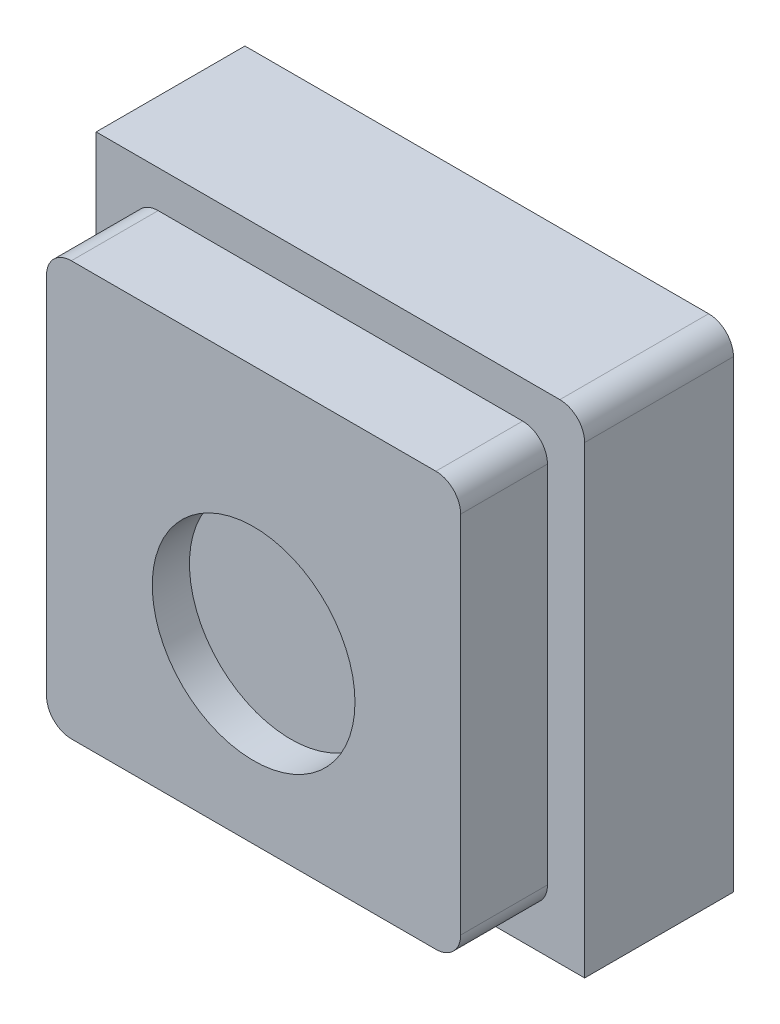
from build123d import *

# Parameters (mm, degrees)
ESQUISSE1_W             = 33.4
ESQUISSE1_H             = 33.4
BOSS_EXTRU_1_DEPTH      = 7
ESQUISSE2_R             = 8.175
ENL_V_MAT_EXTRU_1_DEPTH = 3
ESQUISSE3_W             = 39.4
ESQUISSE3_H             = 39.4
BOSS_EXTRU_2_DEPTH      = 2
BOSS_EXTRU_3_DEPTH      = 10
CONG_1_R                = 2


with BuildPart() as part:
    # Esquisse1 → Boss.-Extru.1 (new body)
    with BuildSketch(Plane.XY):
        Rectangle(ESQUISSE1_W, ESQUISSE1_H)
    extrude(amount=BOSS_EXTRU_1_DEPTH)

    # Esquisse2 → Enlèv. mat.-Extru.1 (cut)
    with BuildSketch(Plane.XY.offset(7)):
        with Locations((0, -2.7)):
            Circle(ESQUISSE2_R)
    extrude(amount=-ENL_V_MAT_EXTRU_1_DEPTH, mode=Mode.SUBTRACT)

    # Esquisse3 → Boss.-Extru.2 (add)
    with BuildSketch(Plane(origin=(0, 0, 0), x_dir=(-1, 0, 0), z_dir=(0, 0, -1))):
        Rectangle(ESQUISSE3_W, ESQUISSE3_H)
    extrude(amount=BOSS_EXTRU_2_DEPTH)

    # Esquisse4 → Boss.-Extru.3 (add)
    with BuildSketch(Plane(origin=(0, 0, -2), x_dir=(-1, 0, 0), z_dir=(0, 0, -1))):
        Polygon((19.7, 19.7), (-19.7, 19.7), (-19.7, -19.7), (-16.7, -19.7), (-16.7, 16.7), (19.7, 16.7), align=None)
    extrude(amount=BOSS_EXTRU_3_DEPTH)

    # Congé1
    cong_1_edges = [part.edges().sort_by_distance(p)[0] for p in [
        (19.7, 19.7, -6),
        (-16.7, 16.7, 3.5),
        (16.7, 16.7, 3.5),
        (16.7, -16.7, 3.5),
        (-16.7, -16.7, 3.5),
    ]]
    fillet(cong_1_edges, radius=CONG_1_R)


solid = part.part
